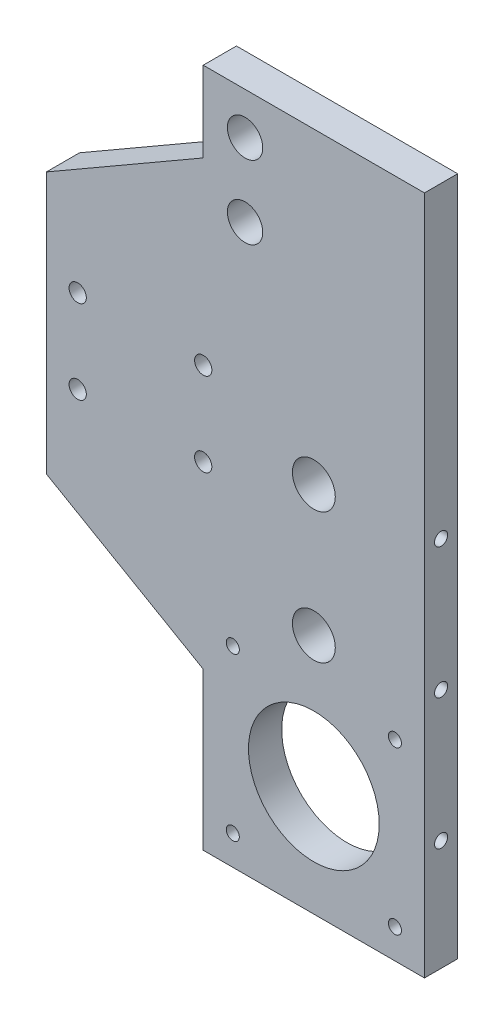
from build123d import *

# Parameters (mm, degrees)
SKETCH2_W                       = 42.3
SKETCH2_H                       = 130
SKETCH2_R                       = 12.5
SKETCH2_R_2                     = 4.1
BOSS_EXTRUDE1_DEPTH             = 6.35
TAP_DRILL_FOR_M3X0_5_TAP1_D     = 2.5
TAP_DRILL_FOR_M3X0_5_TAP1_DEPTH = 21.15
TAP_DRILL_FOR_M3X0_5_TAP1_TIP   = 0.751075774
TAP_DRILL_FOR_M3X0_5_TAP2_D     = 2.5
F_1_4_CLEARANCE_HOLE1_D         = 6.7564
BOSS_EXTRUDE2_DEPTH             = 6.35
TAP_DRILL_FOR_M4X0_7_TAP1_D     = 3.3


with BuildPart() as part:
    # Sketch2 → Boss-Extrude1 (new body)
    with BuildSketch(Plane.XY):
        with Locations((0, 43.85)):
            Rectangle(SKETCH2_W, SKETCH2_H)
        Circle(SKETCH2_R, mode=Mode.SUBTRACT)
        with Locations((0, 25)):
            Circle(SKETCH2_R_2, mode=Mode.SUBTRACT)
        with Locations((0, 50)):
            Circle(SKETCH2_R_2, mode=Mode.SUBTRACT)
    extrude(amount=BOSS_EXTRUDE1_DEPTH)

    # Tap Drill for M3x0.5 Tap1
    with Locations(Plane(origin=(21.15, 0, 0), x_dir=(0, 0, 1), z_dir=(1, 0, 0))):
        with Locations((3.175, -50), (3.175, 0), (3.175, -25)):
            Hole(TAP_DRILL_FOR_M3X0_5_TAP1_D / 2, depth=TAP_DRILL_FOR_M3X0_5_TAP1_DEPTH)
            with Locations((0, 0, -(TAP_DRILL_FOR_M3X0_5_TAP1_DEPTH + TAP_DRILL_FOR_M3X0_5_TAP1_TIP / 2))):  # 118° drill point
                Cone(0, TAP_DRILL_FOR_M3X0_5_TAP1_D / 2, TAP_DRILL_FOR_M3X0_5_TAP1_TIP, mode=Mode.SUBTRACT)

    # Tap Drill for M3x0.5 Tap2 (through all)
    with Locations(Plane.XY.offset(6.35)):
        with Locations((-15.5, 15.5), (-15.5, -15.5), (15.5, -15.5), (15.5, 15.5)):
            Hole(TAP_DRILL_FOR_M3X0_5_TAP2_D / 2)

    # 1/4 Clearance Hole1 (through all)
    with Locations(Plane.XY.offset(6.35)):
        with Locations((-13.15, 86.85), (-13.15, 100.85)):
            Hole(F_1_4_CLEARANCE_HOLE1_D / 2)

    # Sketch13 → Boss-Extrude2 (add)
    with BuildSketch(Plane.XY.offset(6.35)):
        Polygon((-21.15, 8.85), (-51.15, 26.170508076), (-51.15, 76.170508076), (-21.15, 93.491016151), align=None)
    extrude(amount=-BOSS_EXTRUDE2_DEPTH)

    # Tap Drill for M4x0.7 Tap1 (through all)
    with Locations(Plane.XY.offset(6.35)):
        with Locations((-45.15, 59.170508076), (-21.15, 59.170508076), (-21.15, 43.170508076), (-45.15, 43.170508076)):
            Hole(TAP_DRILL_FOR_M4X0_7_TAP1_D / 2)


solid = part.part
